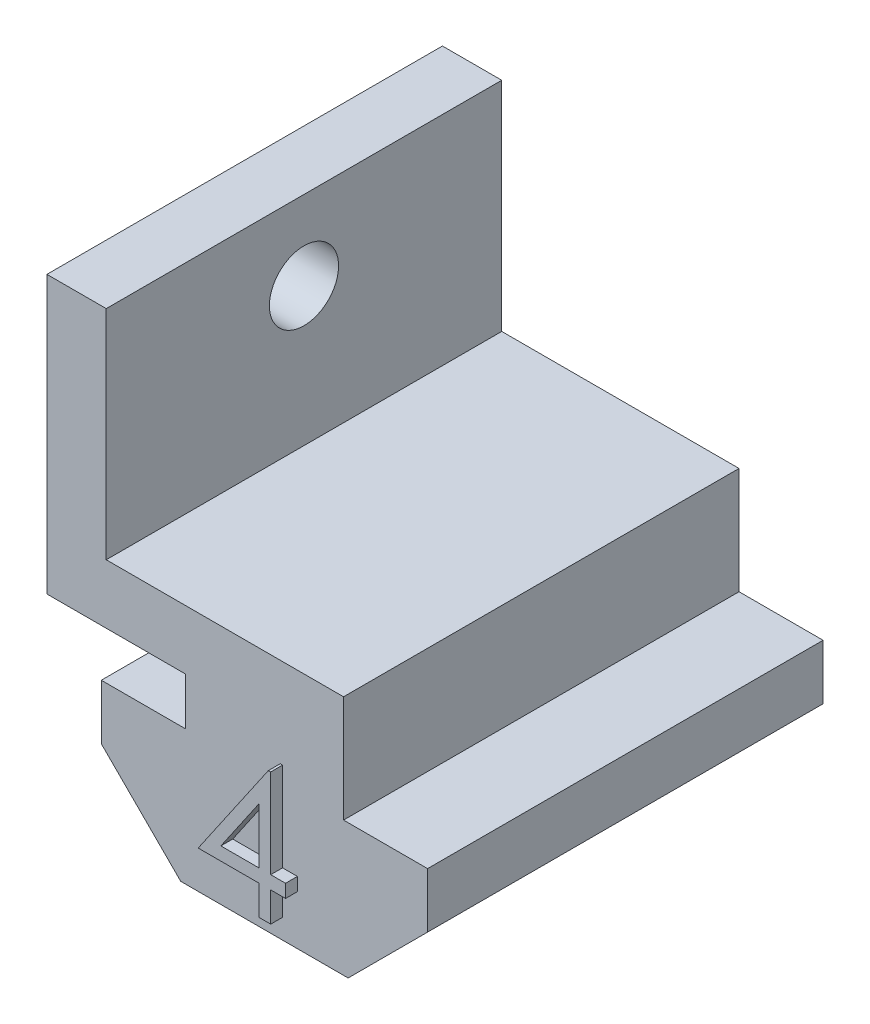
from build123d import *

# Parameters (mm, degrees)
ESTRUSIONE_ESTRUSIONE1_DEPTH = 20
TAGLIO_ESTRUSIONE1_REACH     = 38.177
SCHIZZO6_R                   = 1.75
ESTRUSIONE_ESTRUSIONE2_DEPTH = 0.6


with BuildPart() as part:
    # Schizzo2 → Estrusione-Estrusione1 (new body)
    with BuildSketch(Plane.XY):
        Polygon((-4, 9.2), (-11, 9.2), (-11, 23.2), (-8, 23.2), (-8, 12.2), (4, 12.2), (4, 9.2), (4, 6.8), (8.25, 6.8), (8.25, 4.017766953), (4.232233047, 0), (-4.232233047, 0), (-8.25, 4.017766953), (-8.25, 6.8), (-4, 6.8), align=None)
    extrude(amount=-ESTRUSIONE_ESTRUSIONE1_DEPTH)

    # Schizzo6 → Taglio-Estrusione1 (cut, up to next)
    with BuildSketch(Plane.ZY.offset(11), mode=Mode.PRIVATE) as taglio_estrusione1_sk1:
        with Locations((-10, 19.2)):
            Circle(SCHIZZO6_R)
    taglio_estrusione1_tool1 = extrude(taglio_estrusione1_sk1.sketch, amount=-TAGLIO_ESTRUSIONE1_REACH, mode=Mode.PRIVATE) & part.part
    add(taglio_estrusione1_tool1.solids().sort_by_distance((-11, 19.2, -10))[0], mode=Mode.SUBTRACT)

    # Schizzo7 → Estrusione-Estrusione2 (add)
    with BuildSketch(Plane.XY):
        Polygon((0.798177083, 7.666666667), (0.916666667, 7.666666667), (0.916666667, 3.166666667), (1.666666667, 3.166666667), (1.666666667, 2.5), (0.916666667, 2.5), (0.916666667, 1), (0.333333333, 1), (0.333333333, 2.5), (-2.75, 2.5), align=None)
        Polygon((0.333333333, 3.166666667), (0.333333333, 5.989583333), (-1.604166667, 3.166666667), align=None, mode=Mode.SUBTRACT)
    extrude(amount=ESTRUSIONE_ESTRUSIONE2_DEPTH)


solid = part.part
